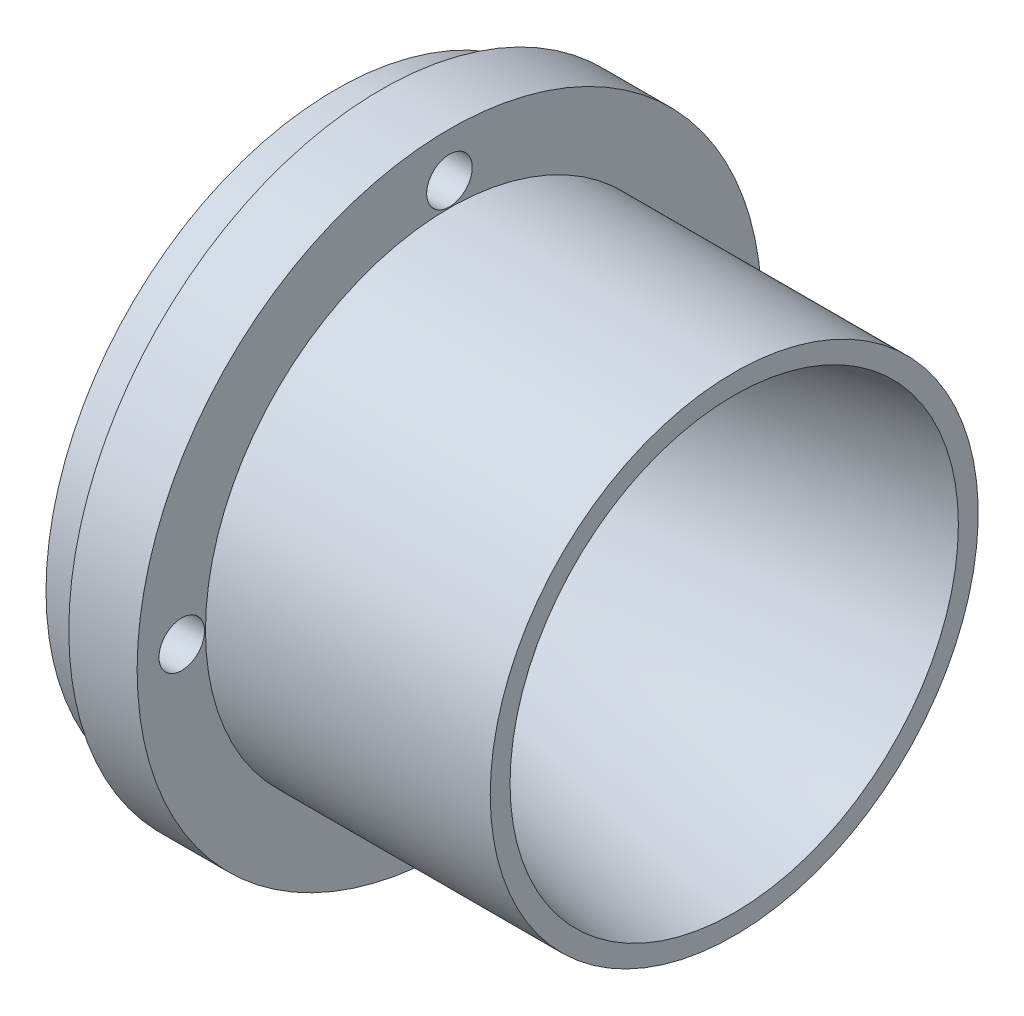
from build123d import *

# Parameters (mm, degrees)
SKETCH1_W         = 101.6
SKETCH1_H         = 34.8234
SKETCH3_W         = 6.35
SKETCH3_H         = 2.667
SKETCH4_W         = 31.75
SKETCH4_H         = 7.62
HOLE1_D           = 3.2639
HOLE1_CBORE_D     = 5.08
HOLE1_CBORE_DEPTH = 4.064
CIRPATTERN1_COUNT = 4
SKETCH12_W        = 1.9304
SKETCH12_H        = 3.0988


with BuildPart() as part:
    # Sketch1 → Revolve1 (revolve)
    with BuildSketch(Plane.XY, mode=Mode.PRIVATE) as revolve1_sk:
        with Locations((50.8, 17.4117)):
            Rectangle(SKETCH1_W, SKETCH1_H)
    revolve(revolve1_sk.sketch.rotate(Axis((-14.406993702, 0, 0), (1, 0, 0)), 90), axis=Axis((-14.406993702, 0, 0), (1, 0, 0)))

    # Sketch2 → Cut-Revolve1 (revolve, cut)
    with BuildSketch(Plane.XY, mode=Mode.PRIVATE) as cut_revolve1_sk:
        with BuildLine():
            Line((0, 28.4734), (10.16, 28.4734))
            ThreePointArc((10.16, 28.4734), (25.296207294, 24.666285192), (36.83, 14.151033402))
            ThreePointArc((36.83, 14.151033402), (41.000418166, 10.205778874), (46.482, 8.5))
            ThreePointArc((46.482, 8.5), (47.320563586, 8.54516677), (48.120613895, 8.800408672))
            ThreePointArc((48.120613895, 8.800408672), (74.283199164, 18.802951678), (101.6, 24.9936))
            Line((101.6, 24.9936), (101.6, 0))
            Line((101.6, 0), (0, 0))
            Line((0, 0), (0, 28.4734))
        make_face()
    revolve(cut_revolve1_sk.sketch.rotate(Axis((-14.406993702, 0, 0), (1, 0, 0)), 90), axis=Axis((-14.406993702, 0, 0), (1, 0, 0)), mode=Mode.SUBTRACT)

    # Sketch3 → Cut-Revolve2 (revolve, cut)
    with BuildSketch(Plane.XY, mode=Mode.PRIVATE) as cut_revolve2_sk:
        with Locations((3.175, 33.4899)):
            Rectangle(SKETCH3_W, SKETCH3_H)
    revolve(cut_revolve2_sk.sketch.rotate(Axis((-14.406993702, 0, 0), (1, 0, 0)), 90), axis=Axis((-14.406993702, 0, 0), (1, 0, 0)), mode=Mode.SUBTRACT)

    # Sketch4 → Cut-Revolve3 (revolve, cut)
    with BuildSketch(Plane.XY, mode=Mode.PRIVATE) as cut_revolve3_sk:
        with Locations((85.725, 31.0134)):
            Rectangle(SKETCH4_W, SKETCH4_H)
    revolve(cut_revolve3_sk.sketch.rotate(Axis((-14.406993702, 0, 0), (1, 0, 0)), 90), axis=Axis((-14.406993702, 0, 0), (1, 0, 0)), mode=Mode.SUBTRACT)

    # Sketch6 → Cut-Revolve4 (revolve, cut)
    with BuildSketch(Plane.XY, mode=Mode.PRIVATE) as cut_revolve4_sk:
        Polygon((57.15, 0), (57.15, 32.2834), (62.23, 32.2834), (62.23, 34.8234), (0, 34.8234), (0, 0), align=None)
    revolve(cut_revolve4_sk.sketch.rotate(Axis((-14.406993702, 0, 0), (1, 0, 0)), 90), axis=Axis((-14.406993702, 0, 0), (1, 0, 0)), mode=Mode.SUBTRACT)

    # Hole1 (through all)
    with Locations(Plane(origin=(69.85, 0, 0), x_dir=(0, 0, -1), z_dir=(1, 0, 0))):
        with Locations((0, 29.845)):
            hole1 = CounterBoreHole(HOLE1_D / 2, HOLE1_CBORE_D / 2, HOLE1_CBORE_DEPTH)

    # CirPattern1: Hole1 ×4 about axis
    cirpattern1_axis = Axis((0, 0, 0), (1, 0, 0))
    for i in range(1, CIRPATTERN1_COUNT):
        add(hole1.rotate(cirpattern1_axis, i * 360 / CIRPATTERN1_COUNT), mode=Mode.SUBTRACT)

    # Sketch12 → Cut-Revolve7 (revolve, cut)
    with BuildSketch(Plane.XY, mode=Mode.PRIVATE) as cut_revolve7_sk:
        with Locations((58.1152, 24.4348)):
            Rectangle(SKETCH12_W, SKETCH12_H)
    revolve(cut_revolve7_sk.sketch.rotate(Axis((-14.406993702, 0, 0), (1, 0, 0)), 90), axis=Axis((-14.406993702, 0, 0), (1, 0, 0)), mode=Mode.SUBTRACT)


solid = part.part
